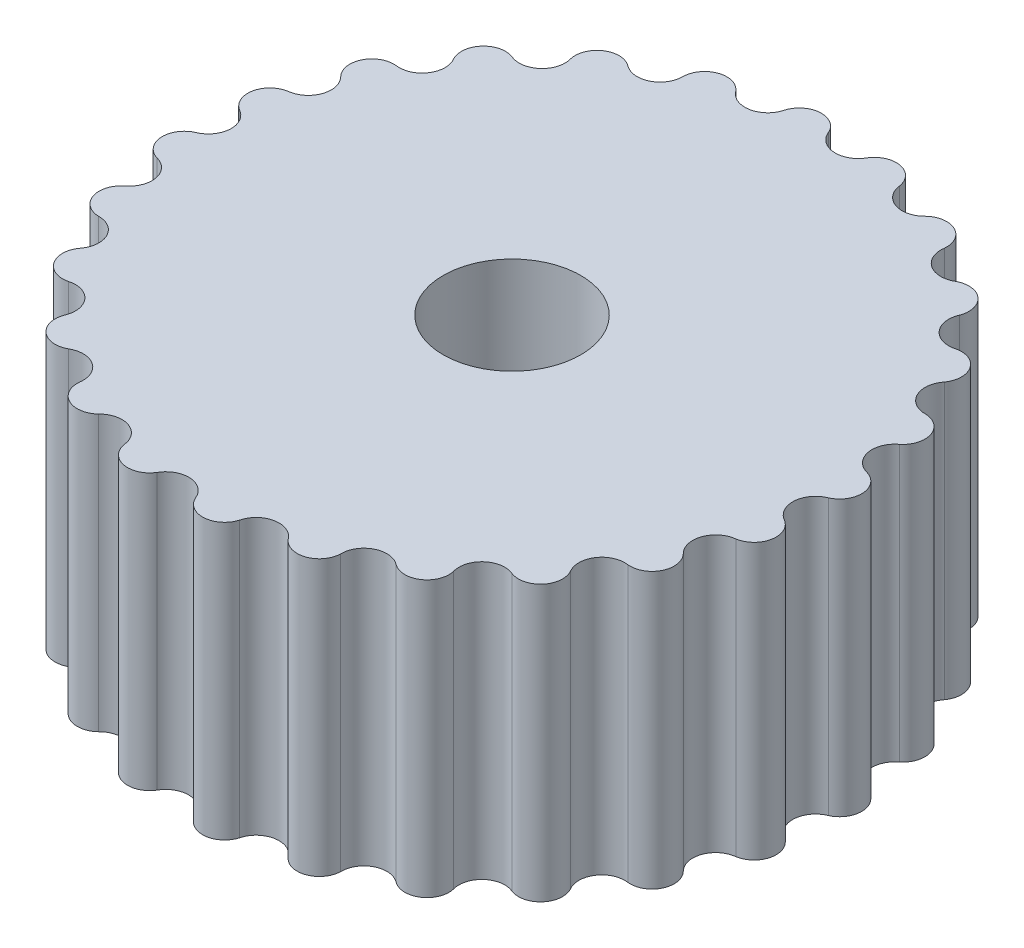
from build123d import *

# Parameters (mm, degrees)
BOSS_EXTRUDE1_DEPTH = 20
CIRPATTERN1_COUNT   = 24


with BuildPart() as part:
    # Sketch1 → Boss-Extrude1 (new body)
    with BuildSketch(Plane(origin=(0, 0, 0), x_dir=(1, 0, 0), z_dir=(0, 1, 0))):
        with BuildLine():
            Line((0, 23), (0, 5))
            ThreePointArc((0, 5), (0.652630961, 4.957224307), (1.294095226, 4.829629131))
            Line((1.294095226, 4.829629131), (5.952838037, 22.216294005))
            ThreePointArc((5.952838037, 22.216294005), (4.682167728, 23.53884673), (3.002102421, 22.803231812))
            ThreePointArc((3.002102421, 22.803231812), (1.438868843, 21.952896311), (0, 23))
        make_face()
    boss_extrude1 = extrude(amount=BOSS_EXTRUDE1_DEPTH)

    # CirPattern1: Boss-Extrude1 ×24 about axis
    cirpattern1_axis = Axis((0, 0, 0), (0, 1, 0))
    for i in range(1, CIRPATTERN1_COUNT):
        add(boss_extrude1.rotate(cirpattern1_axis, i * 360 / CIRPATTERN1_COUNT))


solid = part.part
